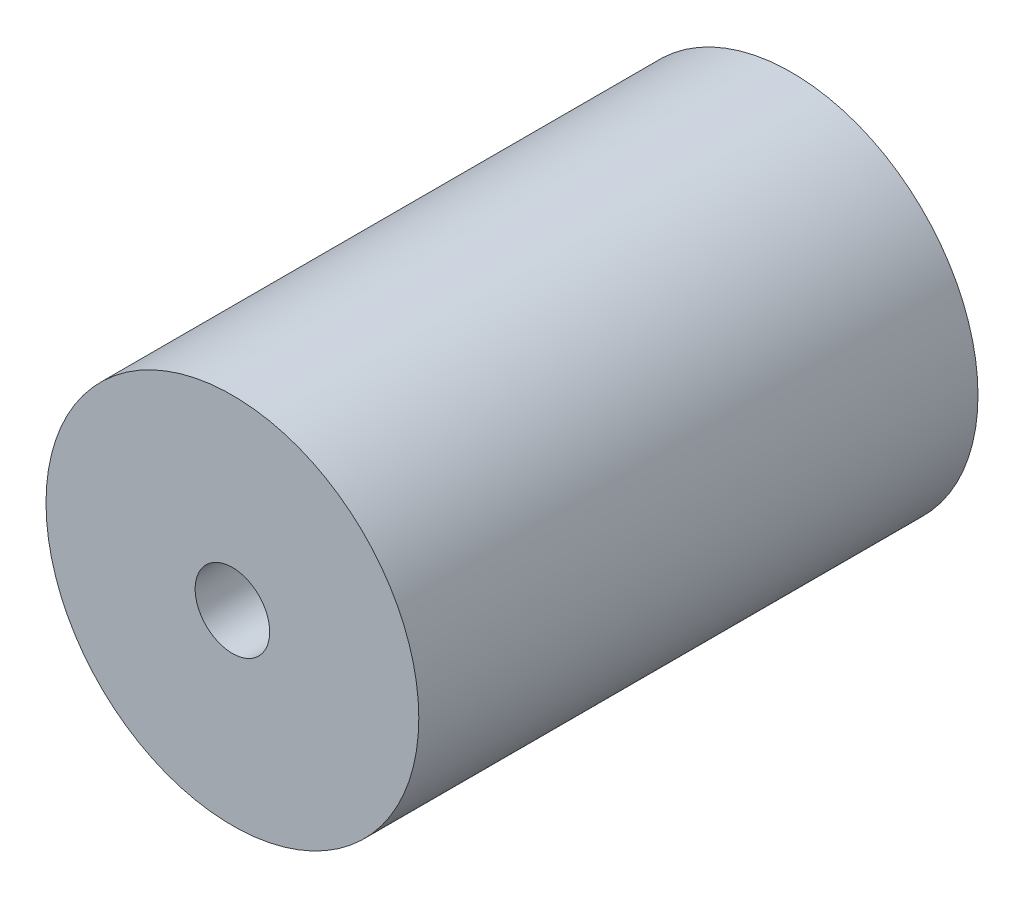
from build123d import *

# Parameters (mm, degrees)
SKETCH1_R           = 10
BOSS_EXTRUDE1_DEPTH = 30
SKETCH2_R           = 2
CUT_EXTRUDE1_DEPTH  = 30
SKETCH3_R           = 3
CUT_EXTRUDE2_DEPTH  = 14


with BuildPart() as part:
    # Sketch1 → Boss-Extrude1 (new body)
    with BuildSketch(Plane.XY):
        Circle(SKETCH1_R)
    extrude(amount=BOSS_EXTRUDE1_DEPTH)

    # Sketch2 → Cut-Extrude1 (cut)
    with BuildSketch(Plane.XY.offset(30)):
        Circle(SKETCH2_R)
    extrude(amount=-CUT_EXTRUDE1_DEPTH, mode=Mode.SUBTRACT)

    # Sketch3 → Cut-Extrude2 (cut)
    with BuildSketch(Plane(origin=(0, 0, 0), x_dir=(-1, 0, 0), z_dir=(0, 0, -1))):
        Circle(SKETCH3_R)
    extrude(amount=-CUT_EXTRUDE2_DEPTH, mode=Mode.SUBTRACT)


solid = part.part
